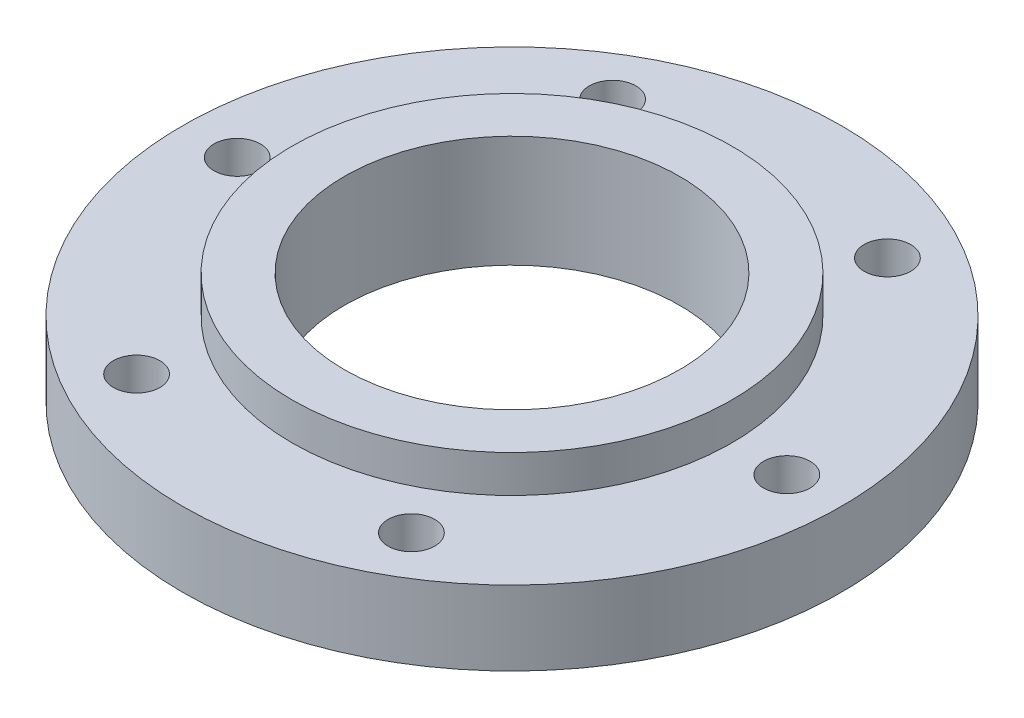
from build123d import *

# Parameters (mm, degrees)
SKETCH1_R           = 22.479
SKETCH1_R_2         = 11.43
BOSS_EXTRUDE1_DEPTH = 5.08
SKETCH2_R           = 14.9987
SKETCH2_R_2         = 11.43
BOSS_EXTRUDE2_DEPTH = 2.54
SKETCH3_R           = 1.5875
CUT_EXTRUDE1_DEPTH  = 33.193435387


with BuildPart() as part:
    # Sketch1 → Boss-Extrude1 (new body)
    with BuildSketch(Plane(origin=(0, 0, 0), x_dir=(1, 0, 0), z_dir=(0, 1, 0))):
        with Locations(Location((0, 0, 0), (0, 0, 270))):
            Circle(SKETCH1_R)
        with Locations(Location((0, 0, 0), (0, 0, 270))):
            Circle(SKETCH1_R_2, mode=Mode.SUBTRACT)
    extrude(amount=BOSS_EXTRUDE1_DEPTH)

    # Sketch2 → Boss-Extrude2 (add)
    with BuildSketch(Plane(origin=(0, 5.08, 0), x_dir=(1, 0, 0), z_dir=(0, 1, 0))):
        with Locations(Location((0, 0, 0), (0, 0, 270))):
            Circle(SKETCH2_R)
        with Locations(Location((0, 0, 0), (0, 0, 270))):
            Circle(SKETCH2_R_2, mode=Mode.SUBTRACT)
    extrude(amount=BOSS_EXTRUDE2_DEPTH)

    # Sketch3 → Cut-Extrude1 (cut, through all)
    with BuildSketch(Plane(origin=(0, 5.08, 0), x_dir=(1, 0, 0), z_dir=(0, 1, 0))):
        with Locations(Location((-18.745423357, 0, 0), (0, 0, 270))):
            Circle(SKETCH3_R)
        with Locations(Location((-9.372711679, 16.234012832, 0), (0, 0, 270))):
            Circle(SKETCH3_R)
        with Locations(Location((9.372711679, 16.234012832, 0), (0, 0, 270))):
            Circle(SKETCH3_R)
        with Locations(Location((18.745423357, 0, 0), (0, 0, 270))):
            Circle(SKETCH3_R)
        with Locations(Location((9.372711679, -16.234012832, 0), (0, 0, 270))):
            Circle(SKETCH3_R)
        with Locations(Location((-9.372711679, -16.234012832, 0), (0, 0, 270))):
            Circle(SKETCH3_R)
    extrude(amount=-CUT_EXTRUDE1_DEPTH, mode=Mode.SUBTRACT)


solid = part.part
